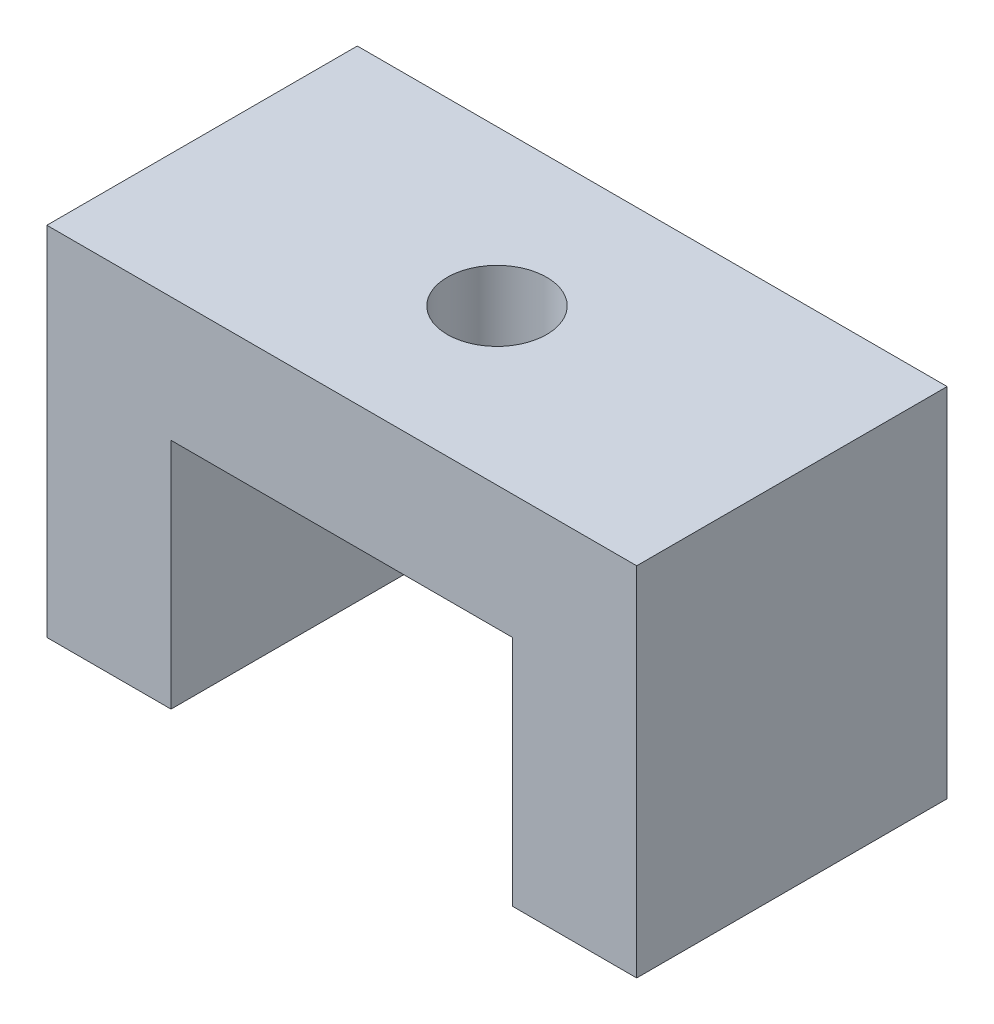
from build123d import *

# Parameters (mm, degrees)
ESQUISSE1_W             = 8
ESQUISSE1_H             = 20
BOSS_EXTRU_1_DEPTH      = 15
BOSS_EXTRU_1_2_DEPTH    = 15
ESQUISSE3_W             = 38
ESQUISSE3_H             = 20
BOSS_EXTRU_2_DEPTH      = 8
ESQUISSE4_R             = 3.2
ENL_V_MAT_EXTRU_1_DEPTH = 10
ESQUISSE1_3_R           = 2
ENL_V_MAT_EXTRU_3_DEPTH = 15


with BuildPart() as part:
    # Esquisse1 → Boss.-Extru.1 (new body)
    with BuildSketch(Plane(origin=(0, 0, 0), x_dir=(1, 0, 0), z_dir=(0, 1, 0))):
        with Locations((-15, 0)):
            Rectangle(ESQUISSE1_W, ESQUISSE1_H)
    extrude(amount=BOSS_EXTRU_1_DEPTH)



with BuildPart() as body_2:
    # Esquisse1 → Boss.-Extru.1 2 (new body)
    with BuildSketch(Plane(origin=(0, 0, 0), x_dir=(1, 0, 0), z_dir=(0, 1, 0))):
        with Locations((15, 0)):
            Rectangle(ESQUISSE1_W, ESQUISSE1_H)
    extrude(amount=BOSS_EXTRU_1_2_DEPTH)


with BuildPart() as part_1:
    add(part.part)

    add(body_2.part)  # Boss.-Extru.2 merges body 2
    # Esquisse3 → Boss.-Extru.2 (add)
    with BuildSketch(Plane(origin=(0, 15, 0), x_dir=(1, 0, 0), z_dir=(0, 1, 0))):
        Rectangle(ESQUISSE3_W, ESQUISSE3_H)
    extrude(amount=BOSS_EXTRU_2_DEPTH)

    # Esquisse4 → Enlèv. mat.-Extru.1 (cut)
    with BuildSketch(Plane(origin=(0, 23, 0), x_dir=(1, 0, 0), z_dir=(0, 1, 0))):
        Circle(ESQUISSE4_R)
    extrude(amount=-ENL_V_MAT_EXTRU_1_DEPTH, mode=Mode.SUBTRACT)

    # Esquisse1<3> → Enlèv. mat.-Extru.3 (cut)
    with BuildSketch(Plane(origin=(0, 0, 0), x_dir=(1, 0, 0), z_dir=(0, 1, 0))):
        with Locations((-15, 0)):
            Circle(ESQUISSE1_3_R)
        with Locations((15, 0)):
            Circle(ESQUISSE1_3_R)
    extrude(amount=ENL_V_MAT_EXTRU_3_DEPTH, mode=Mode.SUBTRACT)


solid = part_1.part
